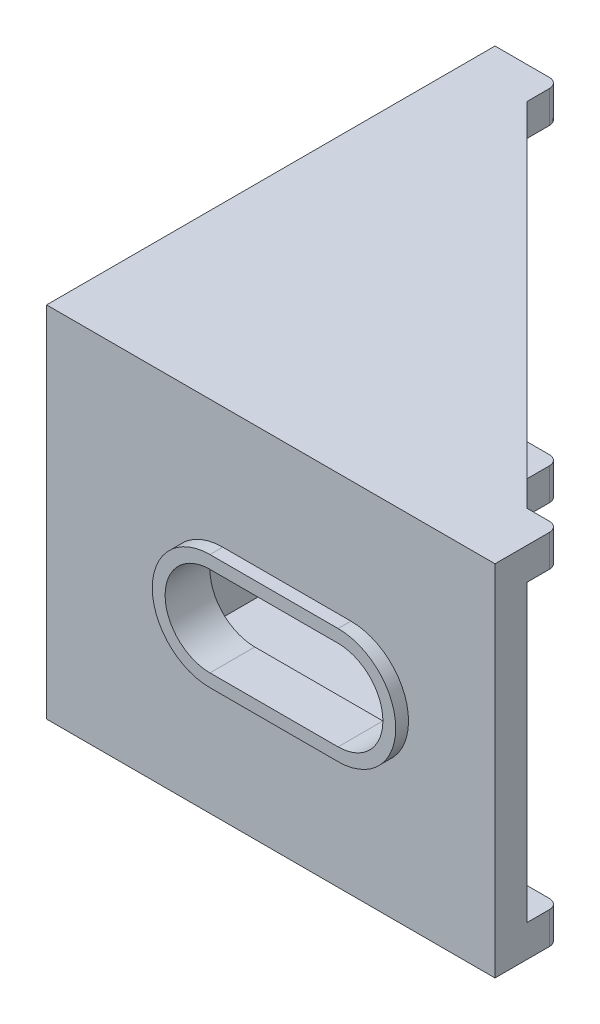
from build123d import *

# Parameters (mm, degrees)
BOSS_EXTRUDE1_DEPTH = 28
BOSS_EXTRUDE2_DEPTH = 2.5
BOSS_EXTRUDE3_START = -25.5
BOSS_EXTRUDE3_DEPTH = 2.5
CUT_EXTRUDE1_DEPTH  = 2.5
CUT_EXTRUDE2_DEPTH  = 2.5
BOSS_EXTRUDE4_DEPTH = 1


with BuildPart() as part:
    # Sketch1 → Boss-Extrude1 (new body)
    with BuildSketch(Plane(origin=(0, 0, 0), x_dir=(1, 0, 0), z_dir=(0, 1, 0))):
        Polygon((0, 0), (0, 35), (2.5, 35), (2.5, 2.5), (35, 2.5), (35, 0), align=None)
    extrude(amount=BOSS_EXTRUDE1_DEPTH)

    # Sketch2 → Boss-Extrude2 (add)
    with BuildSketch(Plane(origin=(0, 28, 0), x_dir=(1, 0, 0), z_dir=(0, 1, 0))):
        with BuildLine():
            Line((2.5, 35), (4.25, 35))
            ThreePointArc((4.25, 35), (4.780330086, 34.780330086), (5, 34.25))
            Line((5, 34.25), (5, 32.5))
            Line((5, 32.5), (32.5, 5))
            Line((32.5, 5), (34.25, 5))
            ThreePointArc((34.25, 5), (34.780330086, 4.780330086), (35, 4.25))
            Line((35, 4.25), (35, 2.5))
            Line((35, 2.5), (2.5, 2.5))
            Line((2.5, 2.5), (2.5, 35))
        make_face()
    extrude(amount=-BOSS_EXTRUDE2_DEPTH)

    # Sketch2<2> → Boss-Extrude3 (add)
    with BuildSketch(Plane(origin=(0, 28, 0), x_dir=(1, 0, 0), z_dir=(0, 1, 0)).offset(BOSS_EXTRUDE3_START)):
        with BuildLine():
            Line((2.5, 35), (4.25, 35))
            ThreePointArc((4.25, 35), (4.780330086, 34.780330086), (5, 34.25))
            Line((5, 34.25), (5, 32.5))
            Line((5, 32.5), (32.5, 5))
            Line((32.5, 5), (34.25, 5))
            ThreePointArc((34.25, 5), (34.780330086, 4.780330086), (35, 4.25))
            Line((35, 4.25), (35, 2.5))
            Line((35, 2.5), (2.5, 2.5))
            Line((2.5, 2.5), (2.5, 35))
        make_face()
    extrude(amount=-BOSS_EXTRUDE3_DEPTH)

    # Sketch3 → Cut-Extrude1 (cut)
    with BuildSketch(Plane(origin=(0, 0, -2.5), x_dir=(-1, 0, 0), z_dir=(0, 0, -1))):
        with BuildLine():
            Line((-23.75, 17.5), (-13.75, 17.5))
            ThreePointArc((-13.75, 17.5), (-10.25, 14), (-13.75, 10.5))
            Line((-13.75, 10.5), (-23.75, 10.5))
            ThreePointArc((-23.75, 10.5), (-27.25, 14), (-23.75, 17.5))
        make_face()
    extrude(amount=-CUT_EXTRUDE1_DEPTH, mode=Mode.SUBTRACT)

    # Sketch4 → Cut-Extrude2 (cut)
    with BuildSketch(Plane(origin=(2.5, 0, 0), x_dir=(0, 0, -1), z_dir=(1, 0, 0))):
        with BuildLine():
            Line((13.75, 17.5), (23.75, 17.5))
            ThreePointArc((23.75, 17.5), (27.25, 14), (23.75, 10.5))
            Line((23.75, 10.5), (13.75, 10.5))
            ThreePointArc((13.75, 10.5), (10.25, 14), (13.75, 17.5))
        make_face()
    extrude(amount=-CUT_EXTRUDE2_DEPTH, mode=Mode.SUBTRACT)

    # Sketch5 → Boss-Extrude4 (add)
    with BuildSketch(Plane.XY):
        with BuildLine():
            Line((13.75, 18.5), (23.75, 18.5))
            ThreePointArc((23.75, 18.5), (28.25, 14), (23.75, 9.5))
            Line((23.75, 9.5), (13.75, 9.5))
            ThreePointArc((13.75, 9.5), (9.25, 14), (13.75, 18.5))
        make_face()
        with BuildLine():
            Line((13.75, 17.5), (23.75, 17.5))
            ThreePointArc((23.75, 17.5), (27.25, 14), (23.75, 10.5))
            Line((23.75, 10.5), (13.75, 10.5))
            ThreePointArc((13.75, 10.5), (10.25, 14), (13.75, 17.5))
        make_face(mode=Mode.SUBTRACT)
    extrude(amount=BOSS_EXTRUDE4_DEPTH)


solid = part.part
